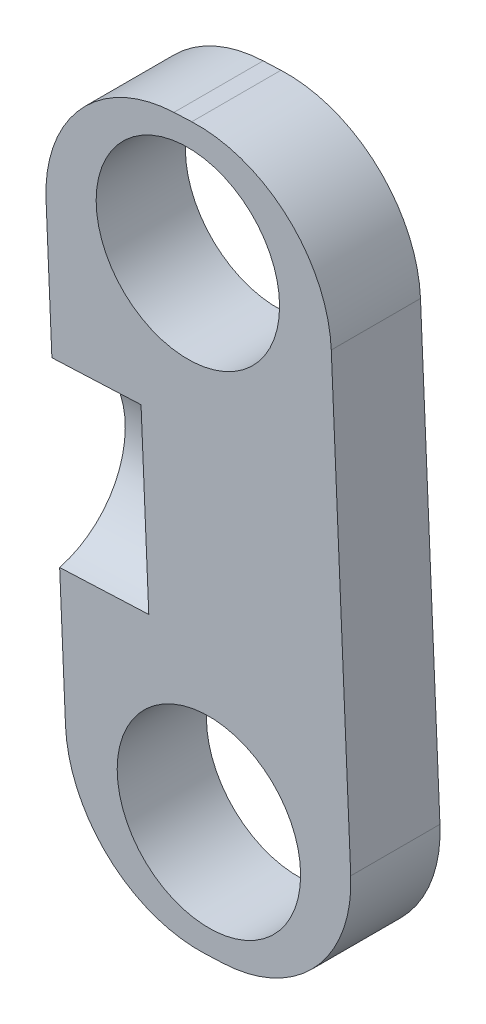
from build123d import *

# Parameters (mm, degrees)
SKETCH1_R           = 3.2639
BOSS_EXTRUDE1_DEPTH = 3.175
FILLET1_R           = 4.7625
SKETCH2_R           = 3.2639
CUT_EXTRUDE1_DEPTH  = 3.175


with BuildPart() as part:
    # Sketch1 → Boss-Extrude1 (new body)
    with BuildSketch(Plane.XY):
        Polygon((200.996661906, 21.487802882), (190.846331975, 21.044629906), (191.954264414, -4.331194922), (202.104594345, -3.888021946), align=None)
        with Locations((196.85, 0)):
            Circle(SKETCH1_R, mode=Mode.SUBTRACT)
        with Locations((196.100926319, 17.15660796)):
            Circle(SKETCH1_R, mode=Mode.SUBTRACT)
    extrude(amount=BOSS_EXTRUDE1_DEPTH)

    # Fillet1
    fillet1_edges = [part.edges().sort_by_distance(p)[0] for p in [
        (202.104594345, -3.888021946, 1.5875),
        (191.954264414, -4.331194922, 1.5875),
        (190.846331975, 21.044629906, 1.5875),
        (200.996661906, 21.487802882, 1.5875),
    ]]
    fillet(fillet1_edges, radius=FILLET1_R)

    # Sketch2 → Cut-Extrude1 (cut)
    with BuildSketch(Plane(origin=(191.400298194, 8.356717492, 0), x_dir=(0, 0, 1), z_dir=(-0.9990482215818578, -0.043619387365334696, 0))):
        with Locations((3.96875, 0)):
            Circle(SKETCH2_R)
    extrude(amount=-CUT_EXTRUDE1_DEPTH, mode=Mode.SUBTRACT)


solid = part.part
